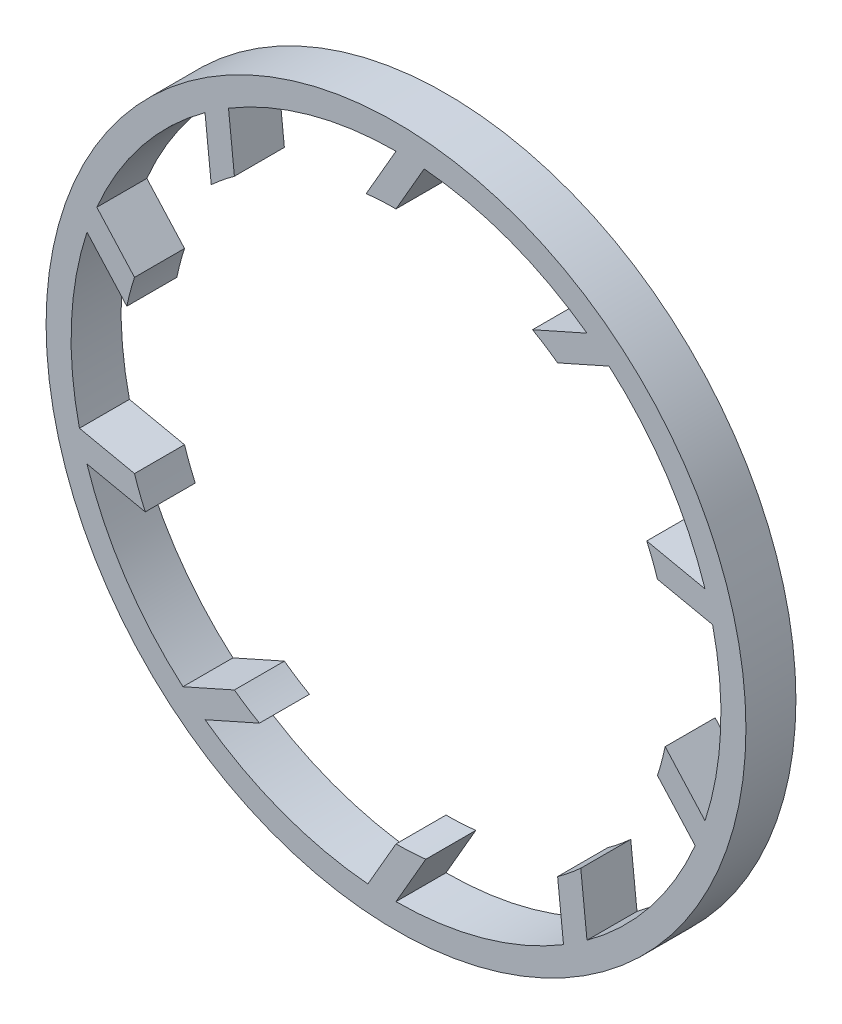
from build123d import *

# Parameters (mm, degrees)
SKETCH1_R           = 35
BOSS_EXTRUDE2_DEPTH = 2.5
SCALE1_SCALE        = 1.5


with BuildPart() as part:
    # Sketch1 → Boss-Extrude2 (new, symmetric)
    with BuildSketch(Plane.XY):
        Circle(SKETCH1_R)
        with BuildLine():
            Line((0, 32.5), (-2.980263218, 27.338032686))
            ThreePointArc((-2.980263218, 27.338032686), (-1.492330582, 27.459478317), (0, 27.5))
            Line((0, 27.5), (2.816174435, 32.377757204))
            ThreePointArc((2.816174435, 32.377757204), (11.374035661, 30.444725533), (19.1030207, 26.293052317))
            Line((19.1030207, 26.293052317), (13.657808848, 23.868687803))
            ThreePointArc((13.657808848, 23.868687803), (14.932955588, 23.092354522), (16.164094438, 22.247967345))
            Line((16.164094438, 22.247967345), (21.309501164, 24.538850017))
            ThreePointArc((21.309501164, 24.538850017), (27.096748823, 17.944809925), (30.90933678, 10.043052317))
            Line((30.90933678, 10.043052317), (25.079062147, 11.282315447))
            ThreePointArc((25.079062147, 11.282315447), (25.654360276, 9.904736181), (26.154054198, 8.497967345))
            Line((26.154054198, 8.497967345), (31.663322731, 7.326936169))
            ThreePointArc((31.663322731, 7.326936169), (32.469424919, -1.409413153), (30.90933678, -10.043052317))
            Line((30.90933678, -10.043052317), (26.920966111, -5.613517939))
            ThreePointArc((26.920966111, -5.613517939), (26.576671298, -7.066154732), (26.154054198, -8.497967345))
            Line((26.154054198, -8.497967345), (29.922831212, -12.683618263))
            ThreePointArc((29.922831212, -12.683618263), (25.439884291, -20.225288311), (19.1030207, -26.293052317))
            Line((19.1030207, -26.293052317), (18.479976031, -20.365178268))
            ThreePointArc((18.479976031, -20.365178268), (17.347597192, -21.338014708), (16.164094438, -22.247967345))
            Line((16.164094438, -22.247967345), (16.75283521, -27.849461618))
            ThreePointArc((16.75283521, -27.849461618), (8.693172534, -31.315790766), (0, -32.5))
            Line((0, -32.5), (2.980263218, -27.338032686))
            ThreePointArc((2.980263218, -27.338032686), (1.492330582, -27.459478317), (0, -27.5))
            Line((0, -27.5), (-2.816174435, -32.377757204))
            ThreePointArc((-2.816174435, -32.377757204), (-11.374035661, -30.444725533), (-19.1030207, -26.293052317))
            Line((-19.1030207, -26.293052317), (-13.657808848, -23.868687803))
            ThreePointArc((-13.657808848, -23.868687803), (-14.932955588, -23.092354522), (-16.164094438, -22.247967345))
            Line((-16.164094438, -22.247967345), (-21.309501164, -24.538850017))
            ThreePointArc((-21.309501164, -24.538850017), (-27.096748823, -17.944809925), (-30.90933678, -10.043052317))
            Line((-30.90933678, -10.043052317), (-25.079062147, -11.282315447))
            ThreePointArc((-25.079062147, -11.282315447), (-25.654360276, -9.904736181), (-26.154054198, -8.497967345))
            Line((-26.154054198, -8.497967345), (-31.663322731, -7.326936169))
            ThreePointArc((-31.663322731, -7.326936169), (-32.469424919, 1.409413153), (-30.90933678, 10.043052317))
            Line((-30.90933678, 10.043052317), (-26.920966111, 5.613517939))
            ThreePointArc((-26.920966111, 5.613517939), (-26.576671298, 7.066154732), (-26.154054198, 8.497967345))
            Line((-26.154054198, 8.497967345), (-29.922831212, 12.683618263))
            ThreePointArc((-29.922831212, 12.683618263), (-25.439884291, 20.225288311), (-19.1030207, 26.293052317))
            Line((-19.1030207, 26.293052317), (-18.479976031, 20.365178268))
            ThreePointArc((-18.479976031, 20.365178268), (-17.347597192, 21.338014708), (-16.164094438, 22.247967345))
            Line((-16.164094438, 22.247967345), (-16.75283521, 27.849461618))
            ThreePointArc((-16.75283521, 27.849461618), (-8.693172534, 31.315790766), (0, 32.5))
        make_face(mode=Mode.SUBTRACT)
    extrude(amount=BOSS_EXTRUDE2_DEPTH, both=True)


with BuildPart() as part_1:
    # Scale1: scaled about (0, 0, 0)
    add(part.part.scale(SCALE1_SCALE))


solid = part_1.part
